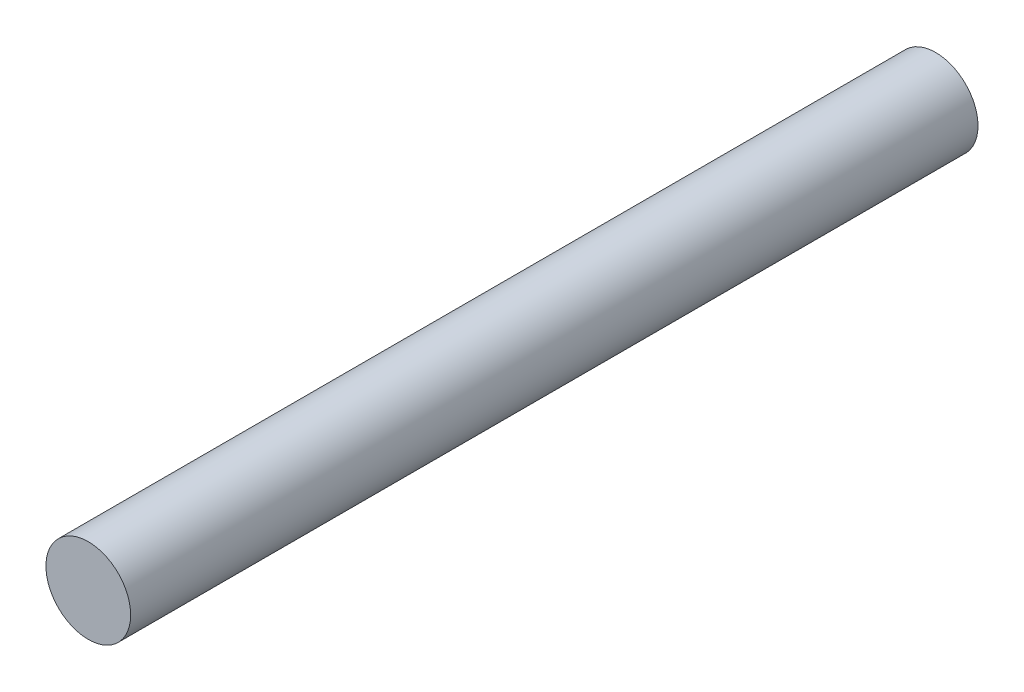
from build123d import *

# Parameters (mm, degrees)
SKETCH1_R           = 1.5
BOSS_EXTRUDE1_DEPTH = 15


with BuildPart() as part:
    # Sketch1 → Boss-Extrude1 (new, symmetric)
    with BuildSketch(Plane.XY):
        Circle(SKETCH1_R)
    extrude(amount=BOSS_EXTRUDE1_DEPTH, both=True)


solid = part.part
